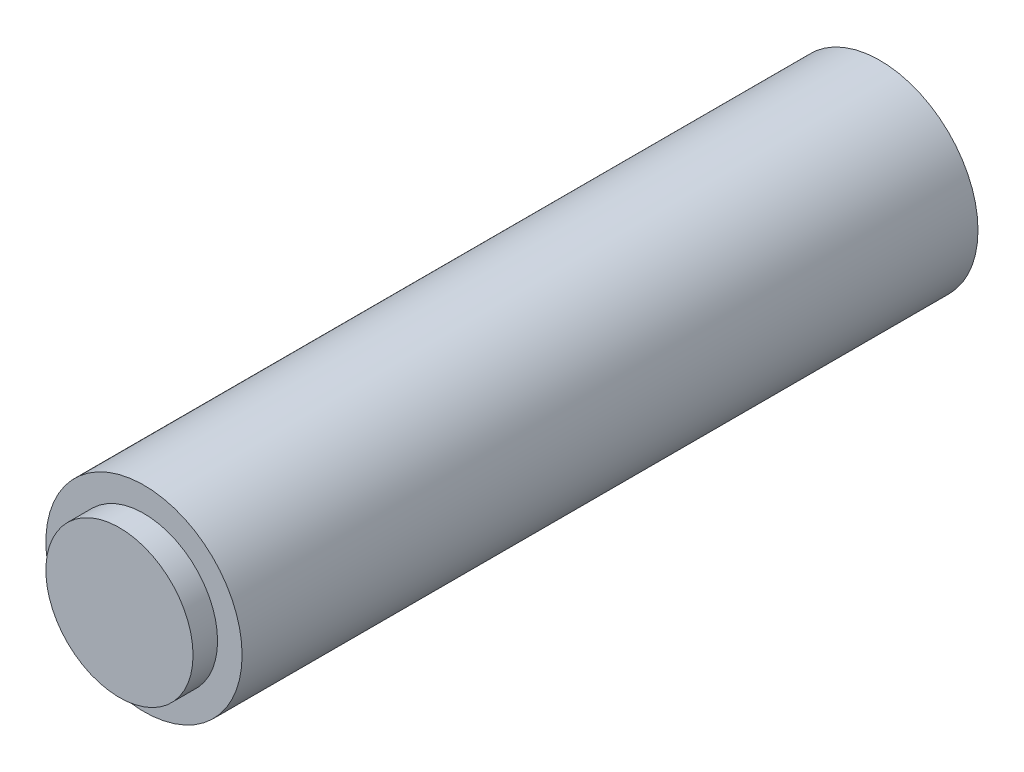
from build123d import *

# Parameters (mm, degrees)
SKETCH_1_R          = 10
EXTRUDE_1_DEPTH     = 77.5
SKETCH_2_OUTSIDE_W  = 38.5
SKETCH_2_OUTSIDE_H  = 38.5
SKETCH_2_OUTSIDE_R  = 7.5
CUT_EXTRUDE_1_DEPTH = 2.5


with BuildPart() as part:
    # Эскиз1 → Бобышка-Вытянуть1 (new body)
    with BuildSketch(Plane.XY):
        Circle(SKETCH_1_R)
    extrude(amount=EXTRUDE_1_DEPTH)

    # Эскиз2 outside → Вырез-Вытянуть1 (cut)
    with BuildSketch(Plane.XY.offset(77.5)):
        Rectangle(SKETCH_2_OUTSIDE_W, SKETCH_2_OUTSIDE_H)
        Circle(SKETCH_2_OUTSIDE_R, mode=Mode.SUBTRACT)
    extrude(amount=-CUT_EXTRUDE_1_DEPTH, mode=Mode.SUBTRACT)


solid = part.part
